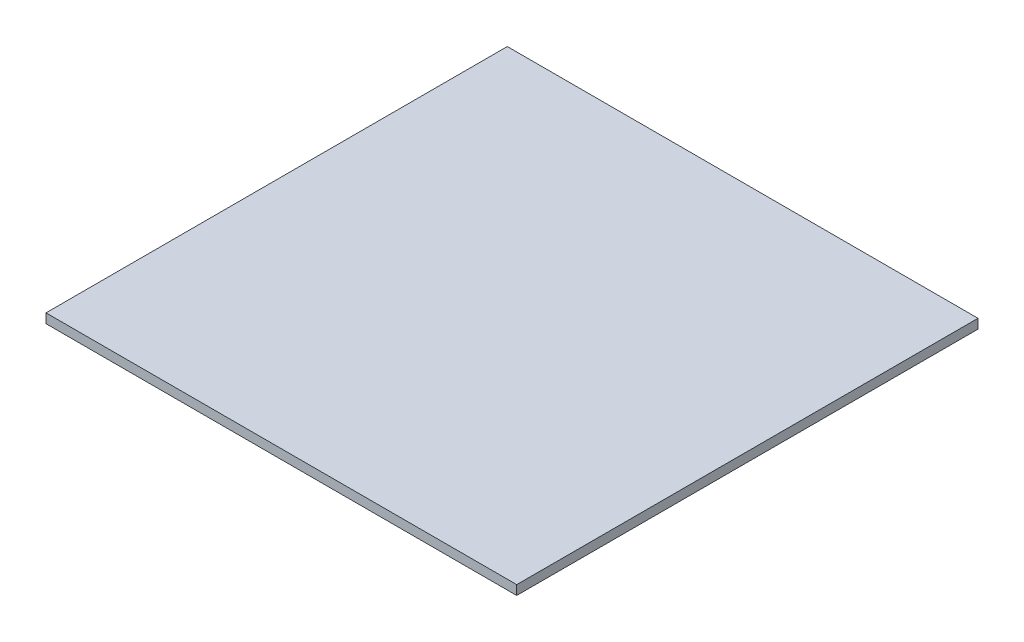
from build123d import *

# Parameters (mm, degrees)
SKETCH1_W           = 635
SKETCH1_H           = 622.3
BOSS_EXTRUDE1_DEPTH = 12.7


with BuildPart() as part:
    # Sketch1 → Boss-Extrude1 (new body)
    with BuildSketch(Plane(origin=(0, 0, 0), x_dir=(1, 0, 0), z_dir=(0, 1, 0))):
        Rectangle(SKETCH1_W, SKETCH1_H)
    extrude(amount=BOSS_EXTRUDE1_DEPTH)


solid = part.part
